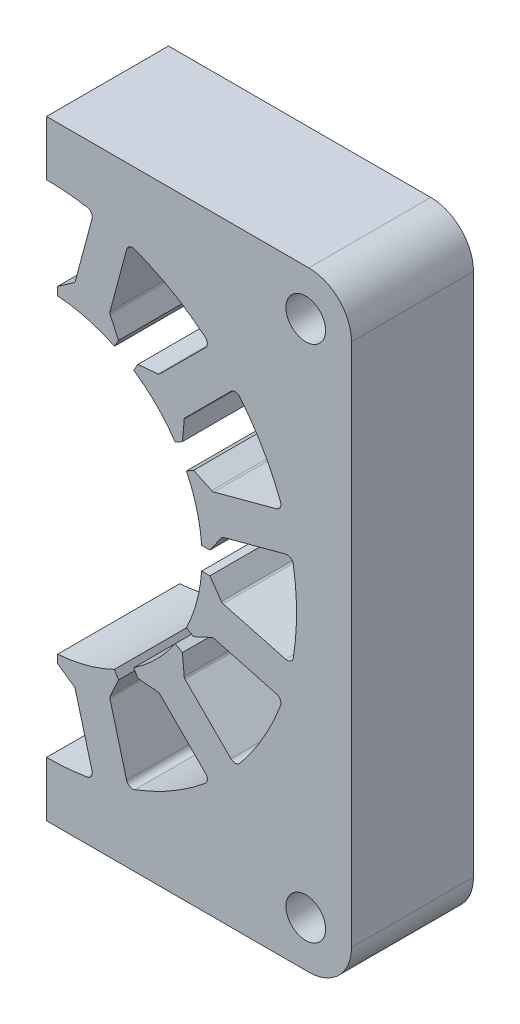
from build123d import *

# Parameters (mm, degrees)
SKETCH1_W                              = 100
SKETCH1_H                              = 100
SKETCH1_R                              = 25.5
LAMINATION_EXTRUCTION_DEPTH            = 20
SLOT_CUT_DEPTH                         = 74.484692283
SLOT_FILLET_TOP_R                      = 1
SLOT_FILLET_BOTTOM_R                   = 0.5
SLOT_DUPLICATE_COUNT                   = 12
SLOT_FILLET_TOP_OF_SLOT_DUPLICATE_R    = 1
SLOT_FILLET_BOTTOM_OF_SLOT_DUPLICATE_R = 0.5
SKETCH3_R                              = 3.25
BOLT_HOLE_CUT_DEPTH                    = 74.484692283
CORNER_FILLET_R                        = 7
SKETCH4_W                              = 50
SKETCH4_H                              = 100
CUT_EXTRUDE1_DEPTH                     = 74.484692283


with BuildPart() as part:
    # Sketch1 → Lamination Extruction (new body)
    with BuildSketch(Plane.XY):
        Rectangle(SKETCH1_W, SKETCH1_H)
        Circle(SKETCH1_R, mode=Mode.SUBTRACT)
    extrude(amount=LAMINATION_EXTRUCTION_DEPTH)

    # Sketch2 → Slot Cut (cut, through all)
    with BuildSketch(Plane.XY.offset(20)):
        with BuildLine():
            Line((4.673479277, 28.779136449), (7.75, 40.260868098))
            ThreePointArc((7.75, 40.260868098), (0, 41), (-7.75, 40.260868098))
            Line((-7.75, 40.260868098), (-4.673479277, 28.779136449))
            Line((-4.673479277, 28.779136449), (-1.825, 26.784609787))
            Line((-1.825, 26.784609787), (-1.825, 25.434609787))
            ThreePointArc((-1.825, 25.434609787), (0, 25.5), (1.825, 25.434609787))
            Line((1.825, 25.434609787), (1.825, 26.784609787))
            Line((1.825, 26.784609787), (4.673479277, 28.779136449))
        make_face()
    slot_cut = extrude(amount=-SLOT_CUT_DEPTH, mode=Mode.SUBTRACT)

    # Slot Fillet Top
    slot_fillet_top_edges = [part.edges().sort_by_distance(p)[0] for p in [
        (-7.75, 40.260868098, 10),
        (7.75, 40.260868098, 10),
    ]]
    fillet(slot_fillet_top_edges, radius=SLOT_FILLET_TOP_R)

    # Slot Fillet Bottom
    slot_fillet_bottom_edges = [part.edges().sort_by_distance(p)[0] for p in [
        (4.673479277, 28.779136449, 10),
        (-4.673479277, 28.779136449, 10),
    ]]
    fillet(slot_fillet_bottom_edges, radius=SLOT_FILLET_BOTTOM_R)

    # Slot Duplicate: Slot Cut ×12 about axis
    slot_duplicate_axis = Axis((0, 0, 0), (0, 0, 1))
    for i in range(1, SLOT_DUPLICATE_COUNT):
        add(slot_cut.rotate(slot_duplicate_axis, i * 360 / SLOT_DUPLICATE_COUNT), mode=Mode.SUBTRACT)

    # Slot Fillet Top of Slot Duplicate
    slot_fillet_top_of_slot_duplicate_edges = [part.edges().sort_by_distance(p)[0] for p in [
        (-26.842130928, 30.991934551, 10),
        (-13.41873717, 38.741934551, 10),
        (-38.741934551, 13.41873717, 10),
        (-30.991934551, 26.842130928, 10),
        (-40.260868098, -7.75, 10),
        (-40.260868098, 7.75, 10),
        (-30.991934551, -26.842130928, 10),
        (-38.741934551, -13.41873717, 10),
        (-13.41873717, -38.741934551, 10),
        (-26.842130928, -30.991934551, 10),
        (7.75, -40.260868098, 10),
        (-7.75, -40.260868098, 10),
        (26.842130928, -30.991934551, 10),
        (13.41873717, -38.741934551, 10),
        (38.741934551, -13.41873717, 10),
        (30.991934551, -26.842130928, 10),
        (40.260868098, 7.75, 10),
        (40.260868098, -7.75, 10),
        (30.991934551, 26.842130928, 10),
        (38.741934551, 13.41873717, 10),
        (13.41873717, 38.741934551, 10),
        (26.842130928, 30.991934551, 10),
    ]]
    fillet(slot_fillet_top_of_slot_duplicate_edges, radius=SLOT_FILLET_TOP_OF_SLOT_DUPLICATE_R)

    # Slot Fillet Bottom of Slot Duplicate
    slot_fillet_bottom_of_slot_duplicate_edges = [part.edges().sort_by_distance(p)[0] for p in [
        (-10.342216447, 27.260202902, 10),
        (-18.436920002, 22.586723625, 10),
        (-22.586723625, 18.436920002, 10),
        (-27.260202902, 10.342216447, 10),
        (-28.779136449, 4.673479277, 10),
        (-28.779136449, -4.673479277, 10),
        (-27.260202902, -10.342216447, 10),
        (-22.586723625, -18.436920002, 10),
        (-18.436920002, -22.586723625, 10),
        (-10.342216447, -27.260202902, 10),
        (-4.673479277, -28.779136449, 10),
        (4.673479277, -28.779136449, 10),
        (10.342216447, -27.260202902, 10),
        (18.436920002, -22.586723625, 10),
        (22.586723625, -18.436920002, 10),
        (27.260202902, -10.342216447, 10),
        (28.779136449, -4.673479277, 10),
        (28.779136449, 4.673479277, 10),
        (27.260202902, 10.342216447, 10),
        (22.586723625, 18.436920002, 10),
        (18.436920002, 22.586723625, 10),
        (10.342216447, 27.260202902, 10),
    ]]
    fillet(slot_fillet_bottom_of_slot_duplicate_edges, radius=SLOT_FILLET_BOTTOM_OF_SLOT_DUPLICATE_R)

    # Sketch3 → Bolt Hole Cut (cut, through all)
    with BuildSketch(Plane.XY.offset(20)):
        with Locations((-42.5, 42.5)):
            Circle(SKETCH3_R)
        with Locations((42.5, 42.5)):
            Circle(SKETCH3_R)
        with Locations((42.5, -42.5)):
            Circle(SKETCH3_R)
        with Locations((-42.5, -42.5)):
            Circle(SKETCH3_R)
    extrude(amount=-BOLT_HOLE_CUT_DEPTH, mode=Mode.SUBTRACT)

    # Corner Fillet
    corner_fillet_edges = [part.edges().sort_by_distance(p)[0] for p in [
        (-50, 50, 10),
        (50, 50, 10),
        (50, -50, 10),
        (-50, -50, 10),
    ]]
    fillet(corner_fillet_edges, radius=CORNER_FILLET_R)

    # Sketch4 → Cut-Extrude1 (cut, through all)
    with BuildSketch(Plane.XY.offset(20)):
        with Locations((-25, 0)):
            Rectangle(SKETCH4_W, SKETCH4_H)
    extrude(amount=-CUT_EXTRUDE1_DEPTH, mode=Mode.SUBTRACT)


solid = part.part
